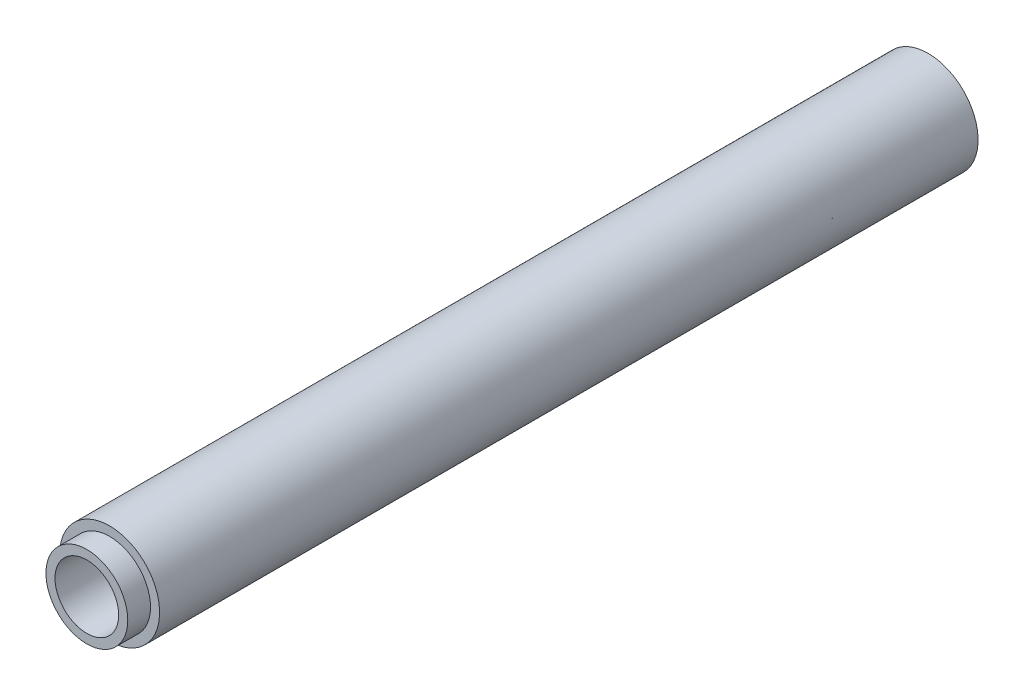
from build123d import *

# Parameters (mm, degrees)
SKETCH_1_R               = 11
EXTRUDE_1_DEPTH          = 180
SKETCH_2_R               = 9
EXTRUDE_2_DEPTH          = 5
CUT_EXTRUDE_1_DEPTH      = 186.652901943
CUT_EXTRUDE_1_DEPTH_BACK = 186.652901943
SKETCH_3_R               = 7


with BuildPart() as part:
    # 草图1 → 凸台-拉伸1 (new body)
    with BuildSketch(Plane.XY):
        with Locations(Location((0, 0, 0), (0, 0, 180))):
            Circle(SKETCH_1_R)
    extrude(amount=EXTRUDE_1_DEPTH)

    # 草图2 → 凸台-拉伸2 (add)
    with BuildSketch(Plane.XY.offset(180)):
        Circle(SKETCH_2_R)
    extrude(amount=EXTRUDE_2_DEPTH)

    # 草图3 → 切除-拉伸1 (cut, two sides: drawn at the far end of the back side and taken through both)
    with BuildSketch(Plane(origin=(0, 0, 0), x_dir=(-1, 0, 0), z_dir=(0, 0, -1)).offset(-CUT_EXTRUDE_1_DEPTH_BACK)):
        Circle(SKETCH_3_R)
    extrude(amount=CUT_EXTRUDE_1_DEPTH + CUT_EXTRUDE_1_DEPTH_BACK, mode=Mode.SUBTRACT)


solid = part.part
